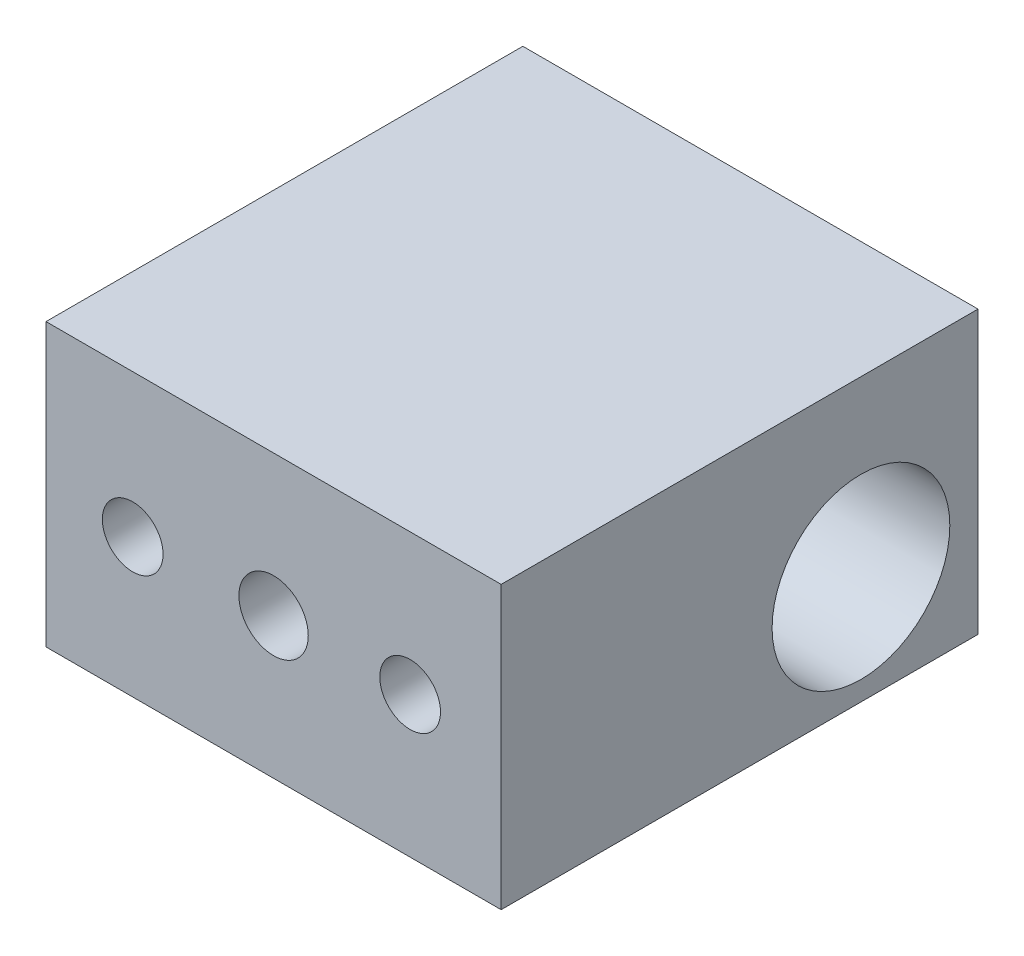
from build123d import *

# Parameters (mm, degrees)
SKETCH_2_W          = 105
SKETCH_2_H          = 65
EXTRUDE_1_DEPTH     = 110
SKETCH_3_R          = 7
SKETCH_3_R_2        = 8
CUT_EXTRUDE_1_DEPTH = 50
SKETCH_4_R          = 20.5
CUT_EXTRUDE_2_DEPTH = 156.503215401


with BuildPart() as part:
    # 草图2 → 凸台-拉伸1 (new body)
    with BuildSketch(Plane.XY):
        Rectangle(SKETCH_2_W, SKETCH_2_H)
    extrude(amount=-EXTRUDE_1_DEPTH)

    # 草图3 → 切除-拉伸1 (cut)
    with BuildSketch(Plane.XY):
        with Locations((-32.5, -0.5)):
            Circle(SKETCH_3_R)
        with Locations((31.5, 0)):
            Circle(SKETCH_3_R)
        Circle(SKETCH_3_R_2)
    extrude(amount=-CUT_EXTRUDE_1_DEPTH, mode=Mode.SUBTRACT)

    # 草图4 → 切除-拉伸2 (cut, through all)
    with BuildSketch(Plane(origin=(52.5, 0, 0), x_dir=(0, 0, -1), z_dir=(1, 0, 0))):
        with Locations(Location((83, -7.5, 0), (0, 0, 90))):
            Circle(SKETCH_4_R)
    extrude(amount=-CUT_EXTRUDE_2_DEPTH, mode=Mode.SUBTRACT)


solid = part.part
